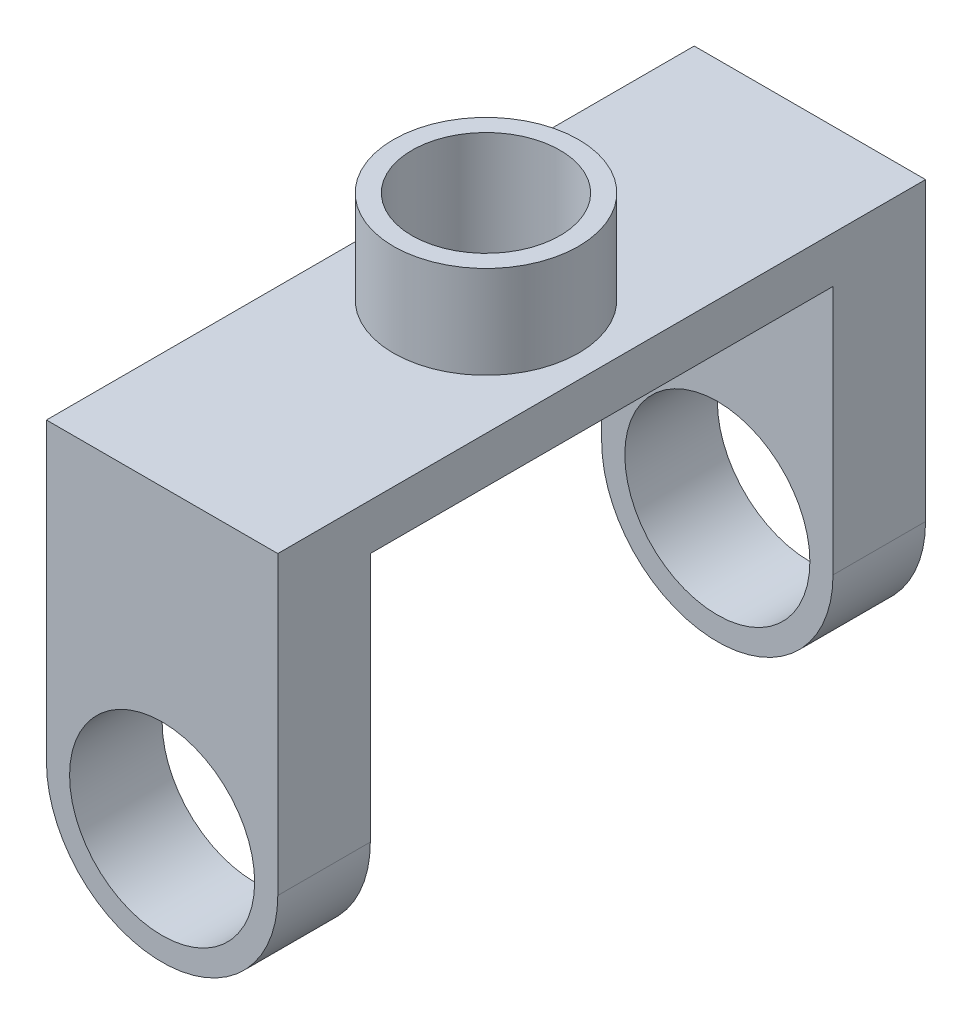
from build123d import *

# Parameters (mm, degrees)
BOSS_EXTRUDE2_DEPTH = 3.5
SKETCH4_R           = 1
CUT_EXTRUDE1_DEPTH  = 8.797595783
SKETCH5_W           = 5
SKETCH5_H           = 3.95
CUT_EXTRUDE2_DEPTH  = 6
SKETCH7_R           = 1
BOSS_EXTRUDE3_DEPTH = 1
SKETCH8_R           = 0.8
CUT_EXTRUDE3_DEPTH  = 2


with BuildPart() as part:
    # Sketch1 → Boss-Extrude2 (new, symmetric)
    with BuildSketch(Plane.XY):
        with BuildLine():
            Line((-1.25, 0), (-1.25, 3.2))
            Line((-1.25, 3.2), (1.25, 3.2))
            Line((1.25, 3.2), (1.25, 0))
            ThreePointArc((1.25, 0), (0, -1.25), (-1.25, 0))
        make_face()
    extrude(amount=BOSS_EXTRUDE2_DEPTH, both=True)

    # Sketch4 → Cut-Extrude1 (cut, through all)
    with BuildSketch(Plane.XY.offset(3.5)):
        Circle(SKETCH4_R)
    extrude(amount=-CUT_EXTRUDE1_DEPTH, mode=Mode.SUBTRACT)

    # Sketch5 → Cut-Extrude2 (cut)
    with BuildSketch(Plane.ZY.offset(1.25)):
        with Locations((0, 0.725)):
            Rectangle(SKETCH5_W, SKETCH5_H)
    extrude(amount=-CUT_EXTRUDE2_DEPTH, mode=Mode.SUBTRACT)

    # Sketch7 → Boss-Extrude3 (add)
    with BuildSketch(Plane(origin=(0, 3.2, 0), x_dir=(1, 0, 0), z_dir=(0, 1, 0))):
        with Locations(Location((0, 0, 0), (0, 0, 270))):
            Circle(SKETCH7_R)
    extrude(amount=BOSS_EXTRUDE3_DEPTH)

    # Sketch8 → Cut-Extrude3 (cut)
    with BuildSketch(Plane(origin=(0, 4.2, 0), x_dir=(1, 0, 0), z_dir=(0, 1, 0))):
        with Locations(Location((0, 0, 0), (0, 0, 270))):
            Circle(SKETCH8_R)
    extrude(amount=-CUT_EXTRUDE3_DEPTH, mode=Mode.SUBTRACT)


solid = part.part
